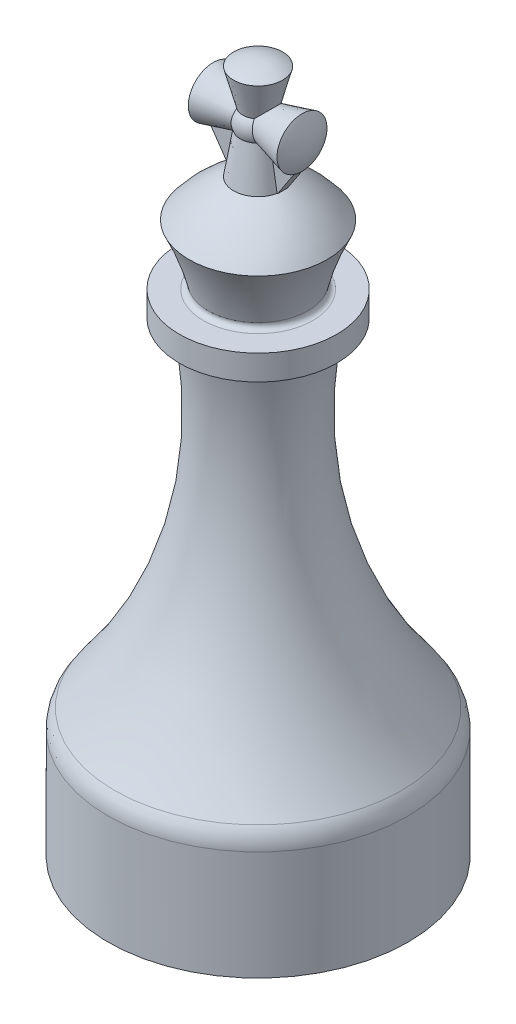
from build123d import *

# Parameters (mm, degrees)
FILLET1_R           = 3
FILLET2_R           = 0.5
BOSS_EXTRUDE2_DEPTH = 0.5


with BuildPart() as part:
    # Sketch1 → Revolve1 (revolve)
    with BuildSketch(Plane.XY):
        with BuildLine():
            Line((9.5, 0), (15, 0))
            Line((15, 0), (15, 12))
            ThreePointArc((15, 12), (6.735083706, 27.814369511), (6, 45.643076036))
            Line((6, 45.643076036), (7.865080572, 46.577618336))
            Line((7.865080572, 46.577618336), (7.865080572, 49.080359627))
            Line((7.865080572, 49.080359627), (4.858044685, 49.080359627))
            ThreePointArc((4.858044685, 49.080359627), (5.688465642, 52.146181823), (6.907044072, 55.07942769))
            ThreePointArc((6.907044072, 55.07942769), (4.882495225, 57.185776118), (2.45012652, 58.804134613))
            Line((2.45012652, 58.804134613), (1.770906359, 62.950202705))
            ThreePointArc((1.770906359, 62.950202705), (1.930656581, 63.958978875), (1.527507616, 64.897392646))
            Line((1.527507616, 64.897392646), (2.45012652, 68.392234364))
            ThreePointArc((2.45012652, 68.392234364), (1.263687374, 68.851825173), (0, 69))
            Line((0, 69), (0, 30))
            Line((0, 30), (7.671617832, 18.17685061))
            ThreePointArc((7.671617832, 18.17685061), (9.03330787, 15.220887487), (9.5, 12))
            Line((9.5, 12), (9.5, 0))
        make_face()
    revolve(axis=Axis((0, 0, 0), (0, 1, 0)))

    # Fillet1
    fillet1_edges = [part.edges().sort_by_distance(p)[0] for p in [
        (-15, 12, 0),
    ]]
    fillet(fillet1_edges, radius=FILLET1_R)

    # Fillet2
    fillet2_edges = [part.edges().sort_by_distance(p)[0] for p in [
        (-4.858044685, 49.080359627, 0),
    ]]
    fillet(fillet2_edges, radius=FILLET2_R)

    # Sketch2 → Revolve2 (revolve)
    with BuildSketch(Plane.XY, mode=Mode.PRIVATE) as revolve2_sk:
        with BuildLine():
            Line((-5.094425774, 63.954758027), (4.996533014, 63.954758027))
            ThreePointArc((4.996533014, 63.954758027), (4.843677484, 62.668449049), (4.388529958, 61.455685127))
            Line((4.388529958, 61.455685127), (-0.04894638, 62.627154362))
            Line((-0.04894638, 62.627154362), (-4.486422717, 61.455685127))
            ThreePointArc((-4.486422717, 61.455685127), (-4.941570243, 62.668449049), (-5.094425774, 63.954758027))
        make_face()
    revolve(revolve2_sk.sketch.rotate(Axis((-5.094425774, 63.954758027, 0), (1, 0, 0)), 270), axis=Axis((-5.094425774, 63.954758027, 0), (1, 0, 0)))

    # Sketch4 → Boss-Extrude2 (add, symmetric)
    with BuildSketch(Plane.XY):
        Polygon((-4.486422717, 61.74861251), (-0.013001056, 62.950202705), (4.388529958, 61.74861251), (2.45012652, 58.804134613), (-2.45012652, 58.804134613), align=None)
    extrude(amount=BOSS_EXTRUDE2_DEPTH, both=True)


solid = part.part
